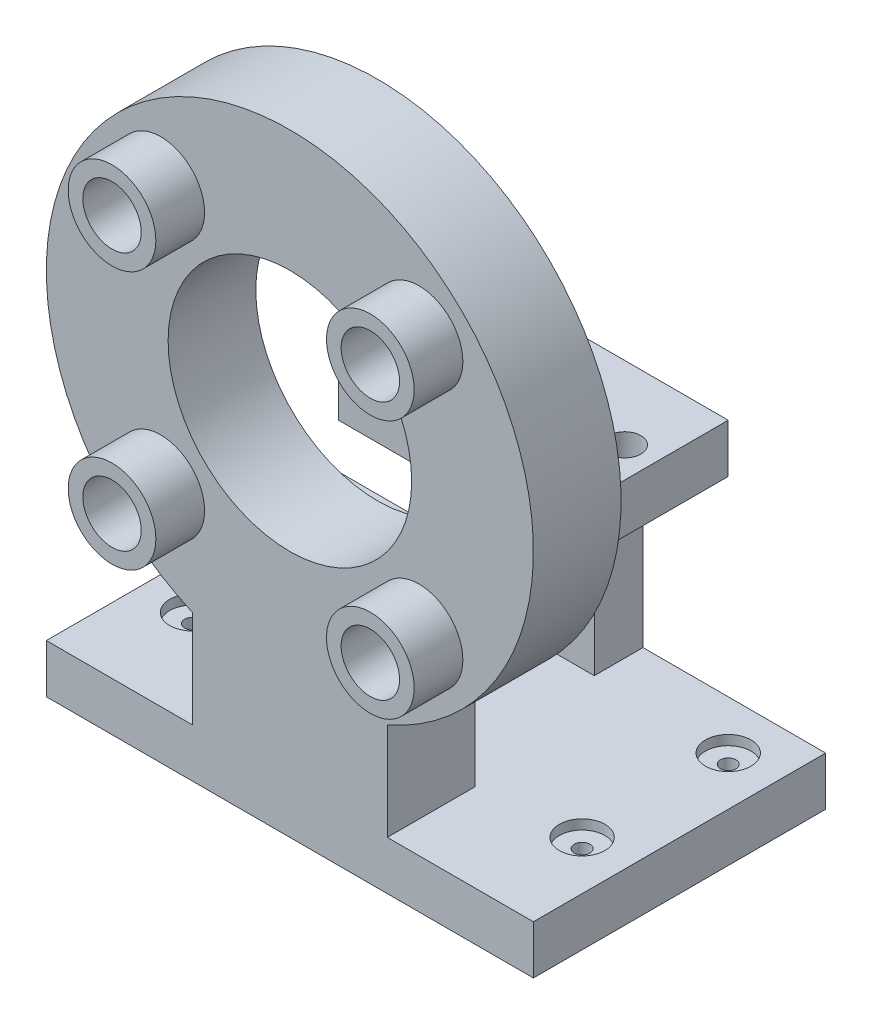
from build123d import *

# Parameters (mm, degrees)
SKETCH1_R                                    = 24.999999999999996
BOSS_EXTRUDE1_DEPTH                          = 10
BOSS_EXTRUDE2_DEPTH                          = 10
BOSS_EXTRUDE3_DEPTH                          = 10
BOSS_EXTRUDE4_DEPTH                          = 10
CUT_EXTRUDE1_REACH                           = 108.182
SKETCH5_R                                    = 6.000000000000003
SKETCH5_R_2                                  = 5.999999999999995
SKETCH5_R_3                                  = 5.999999999999999
SKETCH6_R                                    = 8.999999999999996
SKETCH6_R_2                                  = 5.999999999999995
SKETCH6_R_3                                  = 5.999999999999988
SKETCH6_R_4                                  = 9
SKETCH6_R_5                                  = 5.999999999999991
BOSS_EXTRUDE5_DEPTH                          = 10
CBORE_FOR_M3_HEX_HEAD_CAP_SCREW1_D           = 3.2
CBORE_FOR_M3_HEX_HEAD_CAP_SCREW1_CBORE_D     = 9.351
CBORE_FOR_M3_HEX_HEAD_CAP_SCREW1_CBORE_DEPTH = 2
CUT_EXTRUDE2_REACH                           = 105.242
SKETCH12_R                                   = 3.3000000000000003
CIRPATTERN1_COUNT                            = 4
BOSS_EXTRUDE6_START                          = 8
SKETCH13_R                                   = 6.000000000000003
SKETCH13_R_2                                 = 5.999999999999995
SKETCH13_R_3                                 = 5.999999999999999
SKETCH13_R_4                                 = 25
BOSS_EXTRUDE6_DEPTH                          = 8


with BuildPart() as part:
    # Sketch1 → Boss-Extrude1 (new body)
    # profile 1 of 3: a face of its own
    with BuildSketch(Plane.XY):
        with BuildLine():
            ThreePointArc((50, 0), (-27.386127875258286, 41.83300132670379), (-20.00000000000004, -45.82575694955838))
            Line((-20.000000000000004, -45.82575694955839), (20.000000000000004, -45.82575694955839))
            ThreePointArc((19.999999999999986, -45.825756949558404), (41.83300132670376, -27.38612787525834), (50, -1.225e-14))
        make_face()
        Circle(SKETCH1_R, mode=Mode.SUBTRACT)
    # profile 2 of 3: a face of its own
    with BuildSketch(Plane.XY):
        with BuildLine():
            ThreePointArc((19.999999999999986, -45.825756949558404), (-9.18e-15, -50), (-20.00000000000004, -45.82575694955838))
            Line((-20.000000000000004, -45.82575694955839), (-20, -65.82575694955838))
            Line((-20, -65.82575694955838), (20, -65.82575694955838))
            Line((20, -65.82575694955838), (20.000000000000004, -45.82575694955839))
        make_face()
    # profile 3 of 3: a face of its own
    with BuildSketch(Plane.XY):
        with BuildLine():
            Line((20.000000000000004, -45.82575694955839), (-20.000000000000004, -45.82575694955839))
            ThreePointArc((-20.00000000000004, -45.82575694955838), (-9.18e-15, -50), (19.999999999999986, -45.825756949558404))
        make_face()
    extrude(amount=BOSS_EXTRUDE1_DEPTH)

    # Sketch2 → Boss-Extrude2 (add)
    with BuildSketch(Plane.XZ.offset(65.82575694955838)):
        Polygon((-50, 10), (50, 10), (50.00000000000002, -49.99999999999999), (-49.999999999999986, -49.99999999999999), align=None)
    extrude(amount=BOSS_EXTRUDE2_DEPTH)

    # Sketch3 → Boss-Extrude3 (add)
    with BuildSketch(Plane(origin=(0, 0, -49.99999999999999), x_dir=(-1, 0, 0), z_dir=(0, 0, -1))):
        Polygon((-12.499999999999993, -75.82575694955838), (12.500000000000007, -75.82575694955838), (12.5, -21.65063509461097), (-12.5, -21.65063509461097), align=None)
    extrude(amount=-BOSS_EXTRUDE3_DEPTH)

    # Sketch4 → Boss-Extrude4 (add)
    with BuildSketch(Plane(origin=(0, -21.65063509461097, 0), x_dir=(1, 0, 0), z_dir=(0, 1, 0))):
        Polygon((-25, 24.999999999999996), (-24.999999999999996, 54.99999999999999), (25.000000000000007, 55), (25, 24.999999999999996), align=None)
    extrude(amount=-BOSS_EXTRUDE4_DEPTH)

    # Sketch5 → Cut-Extrude1 (cut, up to next)
    with BuildSketch(Plane(origin=(0, 0, 0), x_dir=(-1, 0, 0), z_dir=(0, 0, -1)), mode=Mode.PRIVATE) as cut_extrude1_sk1:
        with Locations((-26.516504294495405, 26.51650429449565)):
            Circle(SKETCH5_R)
    cut_extrude1_tool1 = extrude(cut_extrude1_sk1.sketch, amount=-CUT_EXTRUDE1_REACH, mode=Mode.PRIVATE) & part.part
    # Sketch5 → Cut-Extrude1 (cut, up to next)
    with BuildSketch(Plane(origin=(0, 0, 0), x_dir=(-1, 0, 0), z_dir=(0, 0, -1)), mode=Mode.PRIVATE) as cut_extrude1_sk2:
        with Locations((26.516504294495764, 26.5165042944953)):
            Circle(SKETCH5_R_2)
    cut_extrude1_tool2 = extrude(cut_extrude1_sk2.sketch, amount=-CUT_EXTRUDE1_REACH, mode=Mode.PRIVATE) & part.part
    # Sketch5 → Cut-Extrude1 (cut, up to next)
    with BuildSketch(Plane(origin=(0, 0, 0), x_dir=(-1, 0, 0), z_dir=(0, 0, -1)), mode=Mode.PRIVATE) as cut_extrude1_sk3:
        with Locations((26.516504294495217, -26.516504294495856)):
            Circle(SKETCH5_R)
    cut_extrude1_tool3 = extrude(cut_extrude1_sk3.sketch, amount=-CUT_EXTRUDE1_REACH, mode=Mode.PRIVATE) & part.part
    # Sketch5 → Cut-Extrude1 (cut, up to next)
    with BuildSketch(Plane(origin=(0, 0, 0), x_dir=(-1, 0, 0), z_dir=(0, 0, -1)), mode=Mode.PRIVATE) as cut_extrude1_sk4:
        with Locations((-26.516504294495945, -26.516504294495114)):
            Circle(SKETCH5_R_3)
    cut_extrude1_tool4 = extrude(cut_extrude1_sk4.sketch, amount=-CUT_EXTRUDE1_REACH, mode=Mode.PRIVATE) & part.part
    add(cut_extrude1_tool1.solids().sort_by_distance((26.516504, 26.516504, 0))[0], mode=Mode.SUBTRACT)
    add(cut_extrude1_tool2.solids().sort_by_distance((-26.516504, 26.516504, 0))[0], mode=Mode.SUBTRACT)
    add(cut_extrude1_tool3.solids().sort_by_distance((-26.516504, -26.516504, 0))[0], mode=Mode.SUBTRACT)
    add(cut_extrude1_tool4.solids().sort_by_distance((26.516504, -26.516504, 0))[0], mode=Mode.SUBTRACT)

    # Sketch6 → Boss-Extrude5 (add)
    # profile 1 of 4: a face of its own
    with BuildSketch(Plane.XY.offset(10)):
        with Locations((-26.516504294495764, 26.5165042944953)):
            Circle(SKETCH6_R)
        with Locations(Location((-26.516504294495764, 26.5165042944953, 0), (0, 0, 180))):
            Circle(SKETCH6_R_2, mode=Mode.SUBTRACT)
    # profile 2 of 4: a face of its own
    with BuildSketch(Plane.XY.offset(10)):
        with Locations((26.516504294495398, 26.51650429449567)):
            Circle(SKETCH6_R)
        with Locations(Location((26.516504294495398, 26.51650429449567, 0), (0, 0, 180))):
            Circle(SKETCH6_R_3, mode=Mode.SUBTRACT)
    # profile 3 of 4: a face of its own
    with BuildSketch(Plane.XY.offset(10)):
        with Locations((26.516504294495572, -26.51650429449549)):
            Circle(SKETCH6_R_4)
        with Locations(Location((26.516504294495572, -26.51650429449549, 0), (0, 0, 180))):
            Circle(SKETCH6_R_5, mode=Mode.SUBTRACT)
    # profile 4 of 4: a face of its own
    with BuildSketch(Plane.XY.offset(10)):
        with Locations((-26.516504294495576, -26.516504294495487)):
            Circle(SKETCH6_R)
        with Locations(Location((-26.516504294495576, -26.516504294495487, 0), (0, 0, 180))):
            Circle(SKETCH6_R_2, mode=Mode.SUBTRACT)
    boss_extrude5 = extrude(amount=BOSS_EXTRUDE5_DEPTH)

    # CBORE for M3 Hex Head Cap Screw1 (through all)
    with Locations(Plane(origin=(0, -65.82575694955838, 0), x_dir=(1, 0, 0), z_dir=(0, 1, 0))):
        with Locations((-40, 40), (40, 40), (40, 10), (-40, 10)):
            CounterBoreHole(CBORE_FOR_M3_HEX_HEAD_CAP_SCREW1_D / 2, CBORE_FOR_M3_HEX_HEAD_CAP_SCREW1_CBORE_D / 2, CBORE_FOR_M3_HEX_HEAD_CAP_SCREW1_CBORE_DEPTH)

    # Sketch12 → Cut-Extrude2 (cut, up to next)
    with BuildSketch(Plane(origin=(0, -21.65063509461097, 0), x_dir=(1, 0, 0), z_dir=(0, 1, 0)), mode=Mode.PRIVATE) as cut_extrude2_sk1:
        with Locations(Location((-18.75, 39.99999999999999, 0), (0, 0, 270))):
            Circle(SKETCH12_R)
    cut_extrude2_tool1 = extrude(cut_extrude2_sk1.sketch, amount=-CUT_EXTRUDE2_REACH, mode=Mode.PRIVATE) & part.part
    # Sketch12 → Cut-Extrude2 (cut, up to next)
    with BuildSketch(Plane(origin=(0, -21.65063509461097, 0), x_dir=(1, 0, 0), z_dir=(0, 1, 0)), mode=Mode.PRIVATE) as cut_extrude2_sk2:
        with Locations(Location((18.750000000000004, 39.99999999999999, 0), (0, 0, 270))):
            Circle(SKETCH12_R)
    cut_extrude2_tool2 = extrude(cut_extrude2_sk2.sketch, amount=-CUT_EXTRUDE2_REACH, mode=Mode.PRIVATE) & part.part
    add(cut_extrude2_tool1.solids().sort_by_distance((-18.75, -21.650635, -40))[0], mode=Mode.SUBTRACT)
    add(cut_extrude2_tool2.solids().sort_by_distance((18.75, -21.650635, -40))[0], mode=Mode.SUBTRACT)

    # CirPattern1: Boss-Extrude5 ×4 about axis
    cirpattern1_axis = Axis((0, 0, 10), (0, 0, -1))
    for i in range(1, CIRPATTERN1_COUNT):
        add(boss_extrude5.rotate(cirpattern1_axis, i * 360 / CIRPATTERN1_COUNT))

    # Sketch13 → Boss-Extrude6 (add)
    with BuildSketch(Plane(origin=(0, 0, 0), x_dir=(-1, 0, 0), z_dir=(0, 0, -1)).offset(BOSS_EXTRUDE6_START)):
        with BuildLine():
            Line((-20.00000000000004, -45.825756949558375), (-20, -65.82575694955838))
            Line((-20, -65.82575694955838), (20, -65.82575694955838))
            Line((20, -65.82575694955838), (19.999999999999982, -45.8257569495584))
            ThreePointArc((19.999999999999982, -45.8257569495584), (3.637e-14, 49.99999999999999), (-20.00000000000004, -45.825756949558375))
        make_face()
        with Locations((26.516504294495217, -26.516504294495856)):
            Circle(SKETCH13_R, mode=Mode.SUBTRACT)
        with Locations((26.516504294495764, 26.5165042944953)):
            Circle(SKETCH13_R_2, mode=Mode.SUBTRACT)
        with Locations((-26.516504294495945, -26.516504294495114)):
            Circle(SKETCH13_R_3, mode=Mode.SUBTRACT)
        with Locations((-26.516504294495405, 26.51650429449565)):
            Circle(SKETCH13_R, mode=Mode.SUBTRACT)
        Circle(SKETCH13_R_4, mode=Mode.SUBTRACT)
    extrude(amount=-BOSS_EXTRUDE6_DEPTH)


solid = part.part
